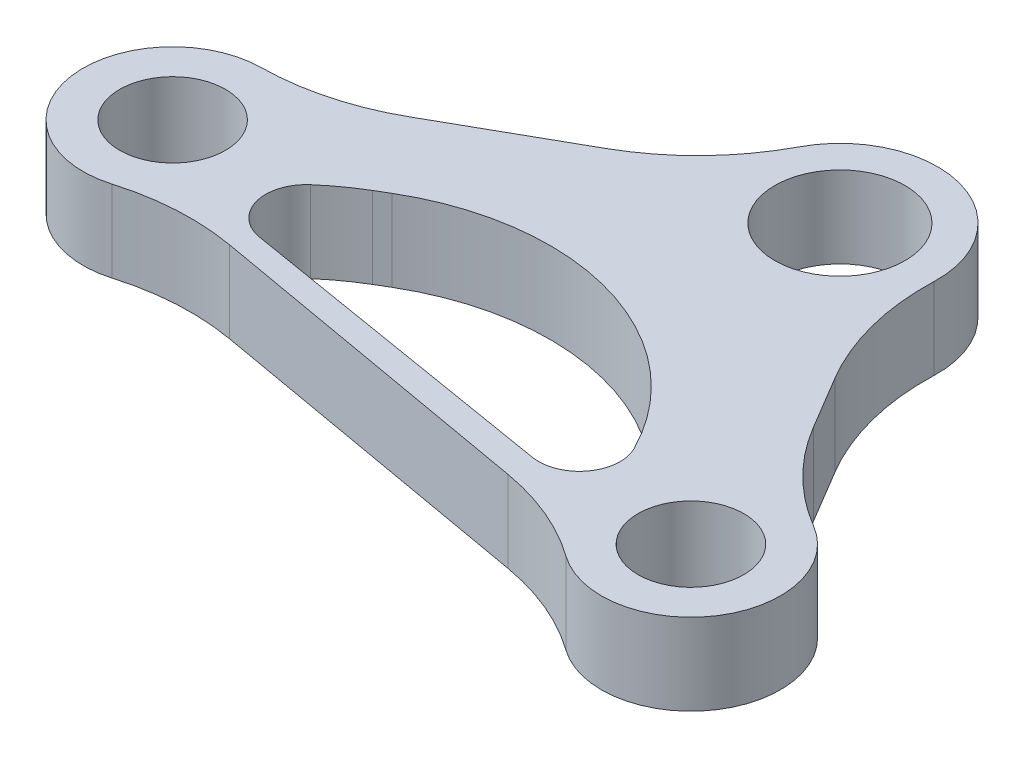
from build123d import *

# Parameters (mm, degrees)
SKETCH1_R           = 6.5
SKETCH1_R_2         = 8
BOSS_EXTRUDE1_DEPTH = 10


with BuildPart() as part:
    # Sketch1 → Boss-Extrude1 (new body)
    with BuildSketch(Plane(origin=(0, 0, 0), x_dir=(1, 0, 0), z_dir=(0, 1, 0))):
        with BuildLine():
            Line((34.360854191, -1.561869431), (30.455482575, 4.991720076))
            ThreePointArc((30.455482575, 4.991720076), (27.168828712, 12.889530967), (26.244815541, 21.393865753))
            ThreePointArc((26.244815541, 21.393865753), (17.347223993, 33.405750066), (3.646755092, 27.426648798))
            ThreePointArc((3.646755092, 27.426648798), (-1.375508537, 20.532192172), (-8.135127404, 15.329864146))
            Line((-8.135127404, 15.329864146), (-23.489726911, 6.674621202))
            ThreePointArc((-23.489726911, 6.674621202), (-30.425083941, 3.839275852), (-37.846730781, 2.810918636))
            ThreePointArc((-37.846730781, 2.810918636), (-48.587233234, -9.823261281), (-34.60716777, -18.741706478))
            ThreePointArc((-34.60716777, -18.741706478), (-27.816143316, -17.570430421), (-20.937015372, -17.979697402))
            Line((-20.937015372, -17.979697402), (20.632426372, -25.309509119))
            ThreePointArc((20.632426372, -25.309509119), (27.032722198, -27.191241227), (32.858920246, -30.440874852))
            ThreePointArc((32.858920246, -30.440874852), (48.469635541, -27.492571895), (44.854019442, -12.022787068))
            ThreePointArc((44.854019442, -12.022787068), (38.951456853, -7.450330386), (34.360854191, -1.561869431))
        make_face()
        with Locations(Location((-37.709427644, -8.188224414, 0), (0, 0, 270))):
            Circle(SKETCH1_R, mode=Mode.SUBTRACT)
        with Locations(Location((14.252094878, 21.811778539, 0), (0, 0, 270))):
            Circle(SKETCH1_R_2, mode=Mode.SUBTRACT)
        with Locations(Location((39.252097338, -21.489490229, 0), (0, 0, 270))):
            Circle(SKETCH1_R, mode=Mode.SUBTRACT)
        with BuildLine():
            Line((20.312704962, -21.992225916), (-19.891412958, -15.327696302))
            ThreePointArc((-19.891412958, -15.327696302), (-23.883928025, -11.759574594), (-22.359792068, -6.626478193))
            ThreePointArc((-22.359792068, -6.626478193), (-20.208737863, -4.917702185), (-17.910389919, -3.41286121))
            Line((-17.910389919, -3.41286121), (-16.434238636, -2.540199474))
            ThreePointArc((-16.434238636, -2.540199474), (7.233462597, 0.434776311), (25.58991918, -14.798446076))
            ThreePointArc((25.58991918, -14.798446076), (25.161933747, -20.017004215), (20.312704962, -21.992225916))
        make_face(mode=Mode.SUBTRACT)
    extrude(amount=BOSS_EXTRUDE1_DEPTH)


solid = part.part
